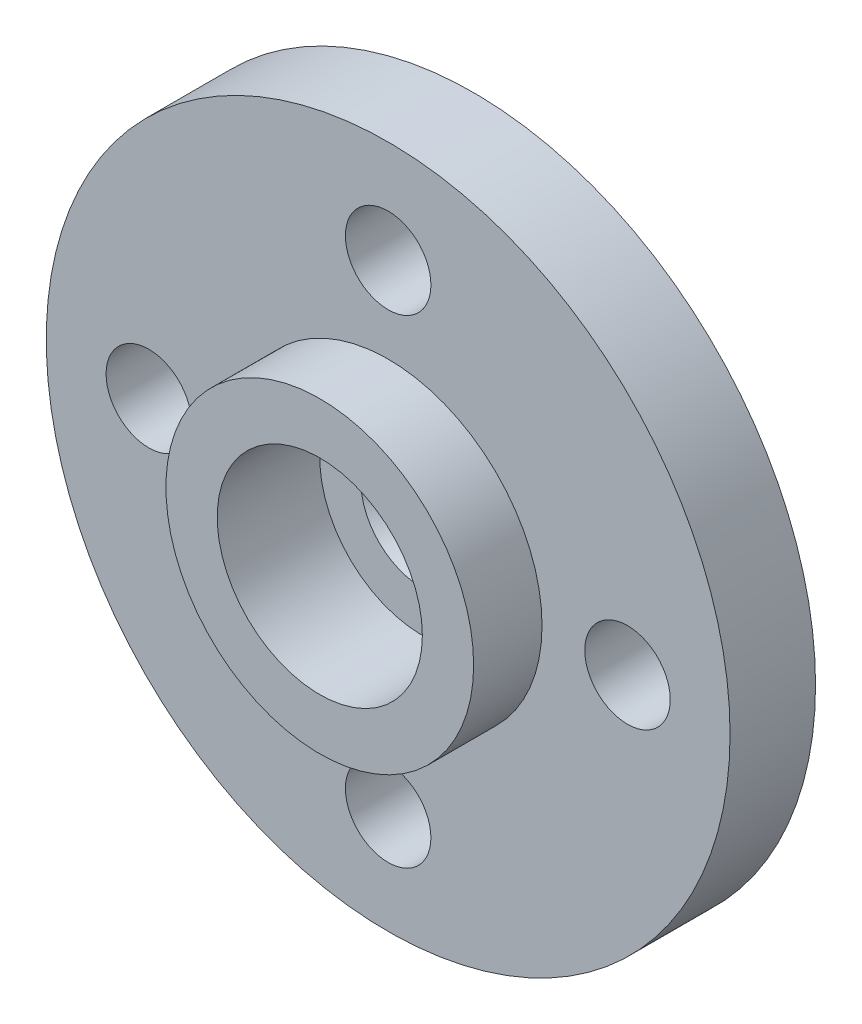
from build123d import *

# Parameters (mm, degrees)
SKETCH_1_R             = 10
SKETCH_1_R_2           = 0.5
SKETCH_1_R_3           = 1.5
EXTRUDE_1_DEPTH        = 2.5
SKETCH_2_R             = 4.5
SKETCH_2_R_2           = 3
EXTRUDE_2_DEPTH        = 2
CUT_EXTRUDE_START      = -1
SKETCH_3_R             = 3
CUT_EXTRUDE_1_DEPTH    = 1
CHAMFER_1_SIZE         = 0.3
HOLE_WIZARD_M3_1_D     = 2.5
HOLE_WIZARD_M3_1_DEPTH = 6.5
HOLE_WIZARD_M3_1_TIP   = 0.751075774


with BuildPart() as part:
    # 草图1 → 凸台-拉伸1 (new body)
    with BuildSketch(Plane.XY):
        Circle(SKETCH_1_R)
        with Locations((0, 7)):
            Circle(SKETCH_1_R_2, mode=Mode.SUBTRACT)
        with Locations((7, 0)):
            Circle(SKETCH_1_R_2, mode=Mode.SUBTRACT)
        with Locations((0, -7)):
            Circle(SKETCH_1_R_2, mode=Mode.SUBTRACT)
        with Locations((-7, 0)):
            Circle(SKETCH_1_R_2, mode=Mode.SUBTRACT)
        Circle(SKETCH_1_R_3, mode=Mode.SUBTRACT)
    extrude(amount=EXTRUDE_1_DEPTH)

    # 草图2 → 凸台-拉伸2 (add)
    with BuildSketch(Plane.XY.offset(2.5)):
        Circle(SKETCH_2_R)
        Circle(SKETCH_2_R_2, mode=Mode.SUBTRACT)
    extrude(amount=EXTRUDE_2_DEPTH)

    # 草图3 → 切除-拉伸1 (cut)
    with BuildSketch(Plane.XY.offset(2.5).offset(CUT_EXTRUDE_START)):
        Circle(SKETCH_3_R)
    extrude(amount=CUT_EXTRUDE_1_DEPTH, mode=Mode.SUBTRACT)

    # 倒角1
    chamfer_1_edges = [part.edges().sort_by_distance(p)[0] for p in [
        (-1.5, 0, 1.5),
    ]]
    chamfer(chamfer_1_edges, length=CHAMFER_1_SIZE)

    # M3 螺纹孔的螺纹孔钻头1
    with Locations(Plane(origin=(0, 0, 0), x_dir=(-1, 0, 0), z_dir=(0, 0, -1))):
        with Locations((0, 7), (7, 0), (0, -7), (-7, 0)):
            Hole(HOLE_WIZARD_M3_1_D / 2, depth=HOLE_WIZARD_M3_1_DEPTH)
            with Locations((0, 0, -(HOLE_WIZARD_M3_1_DEPTH + HOLE_WIZARD_M3_1_TIP / 2))):  # 118° drill point
                Cone(0, HOLE_WIZARD_M3_1_D / 2, HOLE_WIZARD_M3_1_TIP, mode=Mode.SUBTRACT)


solid = part.part
